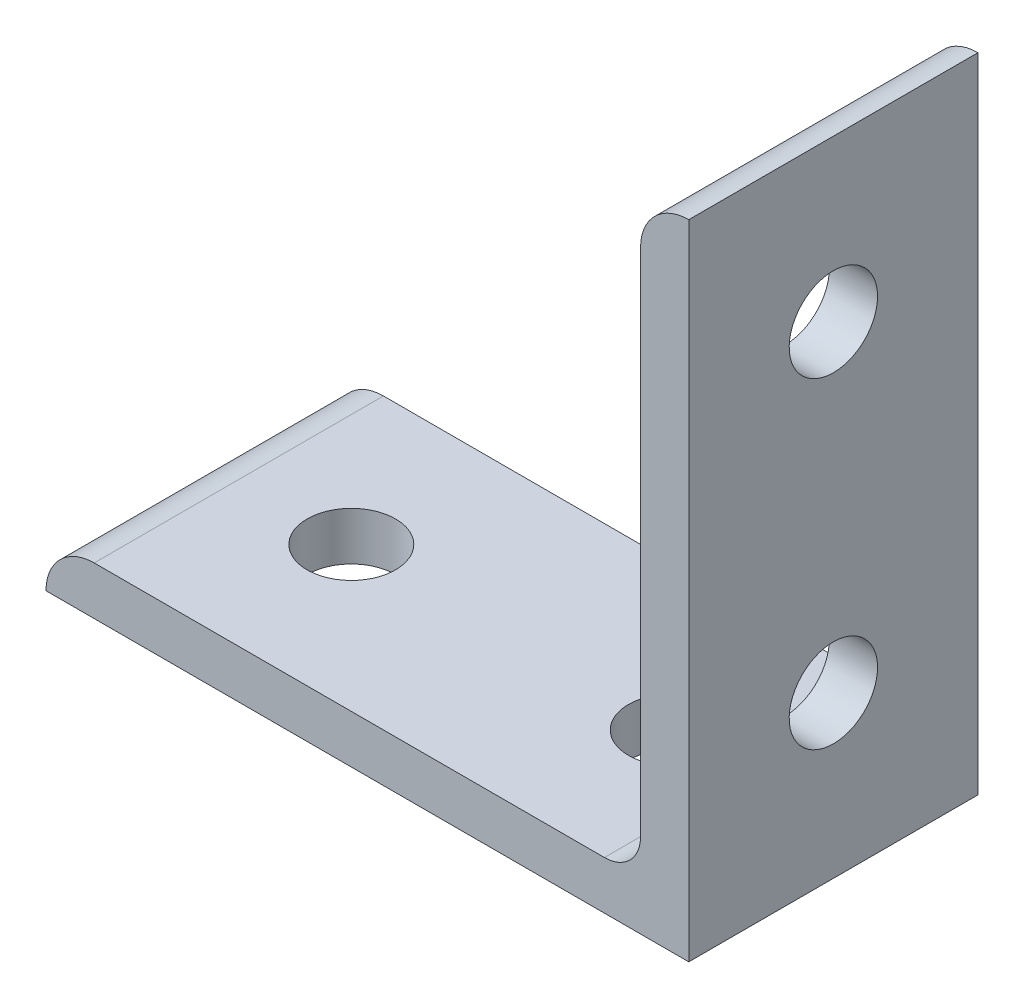
from build123d import *

# Parameters (mm, degrees)
EXTRUDE1_DEPTH     = 9
SKETCH4_R          = 2.75
CUT_EXTRUDE3_DEPTH = 56.226805086
SKETCH5_R          = 2.75
CUT_EXTRUDE4_DEPTH = 56.226805086


with BuildPart() as part:
    # Sketch1 → Extrude1 (new, symmetric)
    with BuildSketch(Plane.XY):
        with BuildLine():
            Line((0, 0), (0, 40))
            ThreePointArc((0, 40), (-2.121320344, 39.121320344), (-3, 37))
            Line((-3, 37), (-3, 5.25))
            ThreePointArc((-3, 5.25), (-3.659009742, 3.659009742), (-5.25, 3))
            Line((-5.25, 3), (-37, 3))
            ThreePointArc((-37, 3), (-39.121320344, 2.121320344), (-40, 0))
            Line((-40, 0), (0, 0))
        make_face()
    extrude(amount=EXTRUDE1_DEPTH, both=True)

    # Sketch4 → Cut-Extrude3 (cut, through all)
    with BuildSketch(Plane(origin=(0, 3, 0), x_dir=(1, 0, 0), z_dir=(0, 1, 0))):
        with Locations(Location((-10, 0, 0), (0, 0, 180))):
            Circle(SKETCH4_R)
        with Locations(Location((-30, 0, 0), (0, 0, 180))):
            Circle(SKETCH4_R)
    extrude(amount=-CUT_EXTRUDE3_DEPTH, mode=Mode.SUBTRACT)

    # Sketch5 → Cut-Extrude4 (cut, through all)
    with BuildSketch(Plane.ZY.offset(3)):
        with Locations(Location((0, 30, 0), (0, 0, 270))):
            Circle(SKETCH5_R)
        with Locations(Location((0, 10, 0), (0, 0, 270))):
            Circle(SKETCH5_R)
    extrude(amount=-CUT_EXTRUDE4_DEPTH, mode=Mode.SUBTRACT)


solid = part.part
